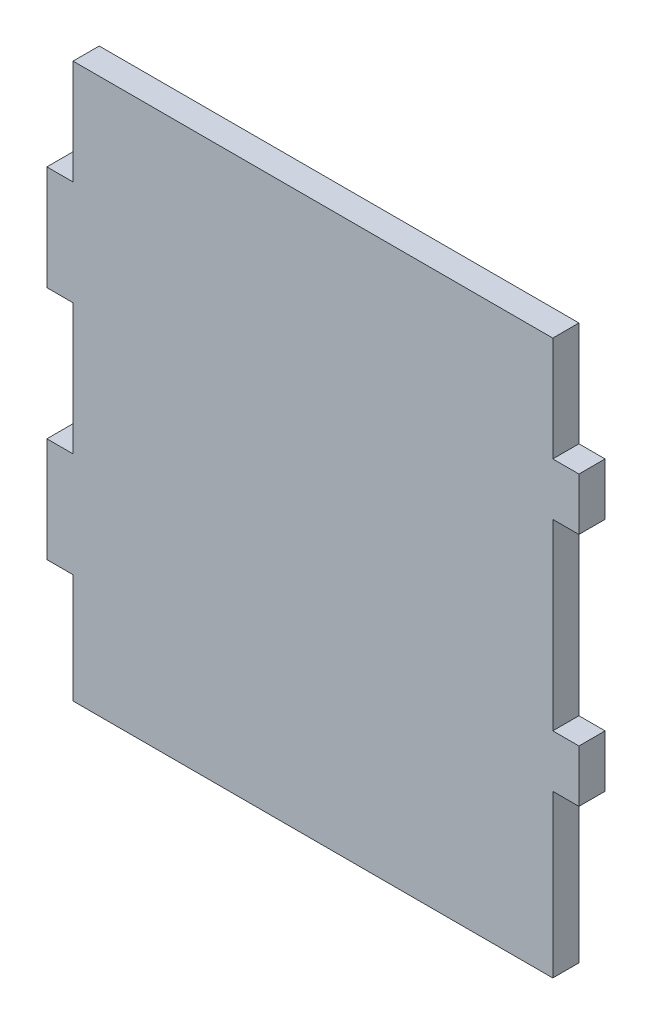
from build123d import *

# Parameters (mm, degrees)
P_IDAT_VYSUNUT_M1_DEPTH = 3


with BuildPart() as part:
    # Skica1 → Přidat vysunutím1 (new body)
    with BuildSketch(Plane.XY):
        Polygon((0, 0), (55, 0), (55, -12), (58, -12), (58, -18), (55, -18), (55, -39), (58, -39), (58, -45), (55, -45), (55, -63.54), (0, -63.54), (0, -51), (-3, -51), (-3, -39), (0, -39), (0, -24), (-3, -24), (-3, -12), (0, -12), align=None)
    extrude(amount=P_IDAT_VYSUNUT_M1_DEPTH)


solid = part.part
